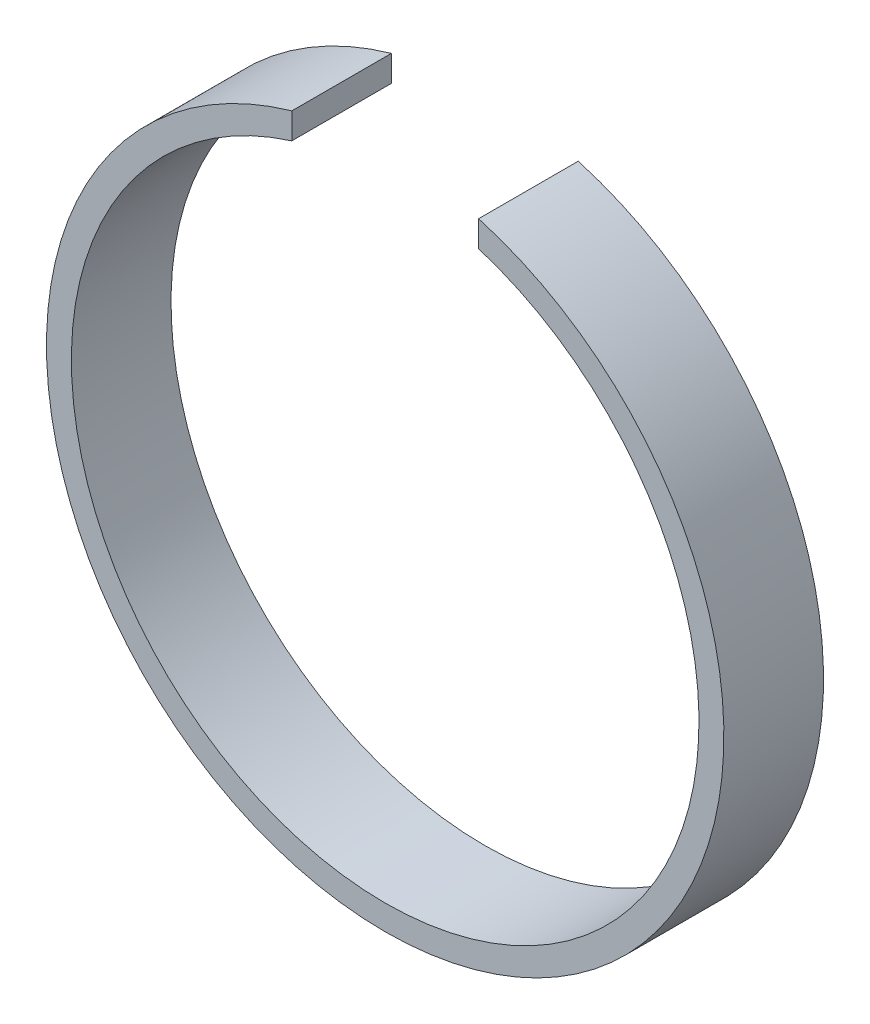
from build123d import *

# Parameters (mm, degrees)
BOSS_EXTRUDE1_DEPTH = 8


with BuildPart() as part:
    # Sketch1 → Boss-Extrude1 (new body)
    with BuildSketch(Plane.XY):
        with BuildLine():
            Line((-100.5, 26.145554115), (-100.5, 24.058054784))
            ThreePointArc((-100.5, 24.058054784), (-93, -25.2), (-85.5, 24.058054784))
            Line((-85.5, 24.058054784), (-85.5, 26.145554115))
            ThreePointArc((-85.5, 26.145554115), (-93, -27.2), (-100.5, 26.145554115))
        make_face()
    extrude(amount=BOSS_EXTRUDE1_DEPTH)


solid = part.part
